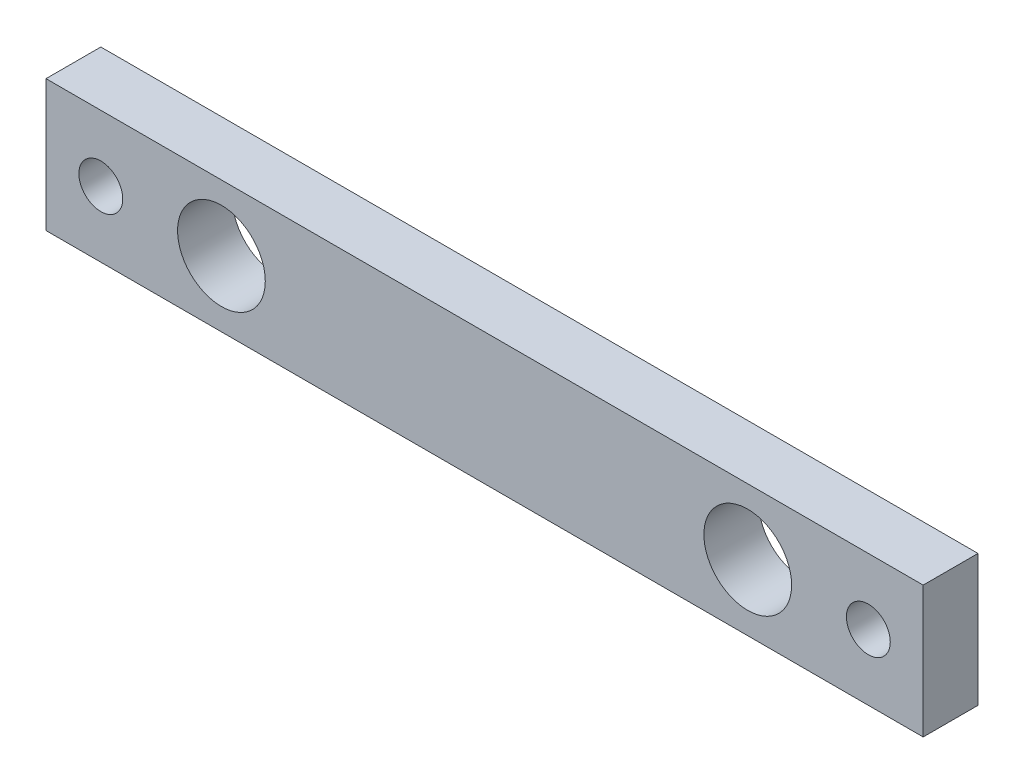
from build123d import *

# Parameters (mm, degrees)
SKETCH1_W           = 80
SKETCH1_H           = 12
SKETCH1_R           = 4
SKETCH1_R_2         = 2
BOSS_EXTRUDE1_DEPTH = 5


with BuildPart() as part:
    # Sketch1 → Boss-Extrude1 (new body)
    with BuildSketch(Plane.XY):
        with Locations((-10, 0)):
            Rectangle(SKETCH1_W, SKETCH1_H)
        with Locations((-34, 0)):
            Circle(SKETCH1_R, mode=Mode.SUBTRACT)
        with Locations((14, 0)):
            Circle(SKETCH1_R, mode=Mode.SUBTRACT)
        with Locations((-45, 0)):
            Circle(SKETCH1_R_2, mode=Mode.SUBTRACT)
        with Locations((25, 0)):
            Circle(SKETCH1_R_2, mode=Mode.SUBTRACT)
    extrude(amount=BOSS_EXTRUDE1_DEPTH)


solid = part.part
